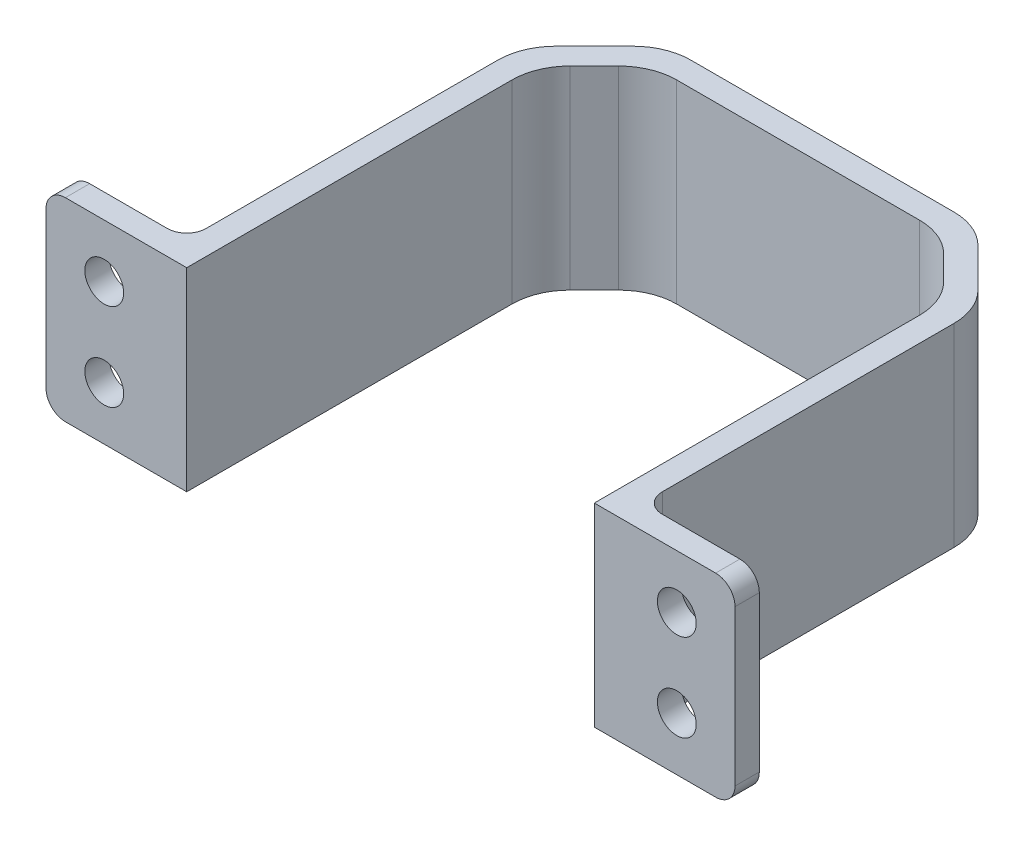
from build123d import *

# Parameters (mm, degrees)
BOSS_EXTRUDE1_DEPTH = 20
SKETCH2_R           = 2
CUT_EXTRUDE1_DEPTH  = 59.51709152
FILLET1_R           = 6
FILLET2_R           = 6
FILLET3_R           = 2
FILLET4_R           = 2


with BuildPart() as part:
    # Sketch1 → Boss-Extrude1 (new body)
    with BuildSketch(Plane(origin=(0, 0, 0), x_dir=(1, 0, 0), z_dir=(0, 1, 0))):
        Polygon((-35.5, 0), (-21, 0), (-21, 36), (-15, 42), (15, 42), (21, 36), (21, 0), (35.5, 0), (35.5, 2.5), (23.5, 2.5), (23.5, 37.035533906), (16.035533906, 44.5), (-16.035533906, 44.5), (-23.5, 37.035533906), (-23.5, 2.5), (-35.5, 2.5), align=None)
    extrude(amount=BOSS_EXTRUDE1_DEPTH)

    # Sketch2 → Cut-Extrude1 (cut, through all)
    with BuildSketch(Plane(origin=(0, 0, -2.5), x_dir=(-1, 0, 0), z_dir=(0, 0, -1))):
        with Locations((29.5, 14.5)):
            Circle(SKETCH2_R)
        with Locations((29.5, 5.5)):
            Circle(SKETCH2_R)
    cut_extrude1 = extrude(amount=-CUT_EXTRUDE1_DEPTH, mode=Mode.SUBTRACT)

    # Mirror1: Cut-Extrude1 across plane
    add(cut_extrude1.mirror(Plane(origin=(0, 0, 0), x_dir=(0, 0, 1), z_dir=(1, 0, 0))), mode=Mode.SUBTRACT)

    # Fillet1
    fillet1_edges = [part.edges().sort_by_distance(p)[0] for p in [
        (-16.035533906, 10, -44.5),
        (16.035533906, 10, -44.5),
        (23.5, 10, -37.035533906),
        (-23.5, 10, -37.035533906),
    ]]
    fillet(fillet1_edges, radius=FILLET1_R)

    # Fillet2
    fillet2_edges = [part.edges().sort_by_distance(p)[0] for p in [
        (21, 10, -36),
        (15, 10, -42),
        (-15, 10, -42),
        (-21, 10, -36),
    ]]
    fillet(fillet2_edges, radius=FILLET2_R)

    # Fillet3
    fillet3_edges = [part.edges().sort_by_distance(p)[0] for p in [
        (23.5, 10, -2.5),
        (-23.5, 10, -2.5),
    ]]
    fillet(fillet3_edges, radius=FILLET3_R)

    # Fillet4
    fillet4_edges = [part.edges().sort_by_distance(p)[0] for p in [
        (-35.5, 20, -1.25),
        (35.5, 0, -1.25),
        (-35.5, 0, -1.25),
        (35.5, 20, -1.25),
    ]]
    fillet(fillet4_edges, radius=FILLET4_R)


solid = part.part
